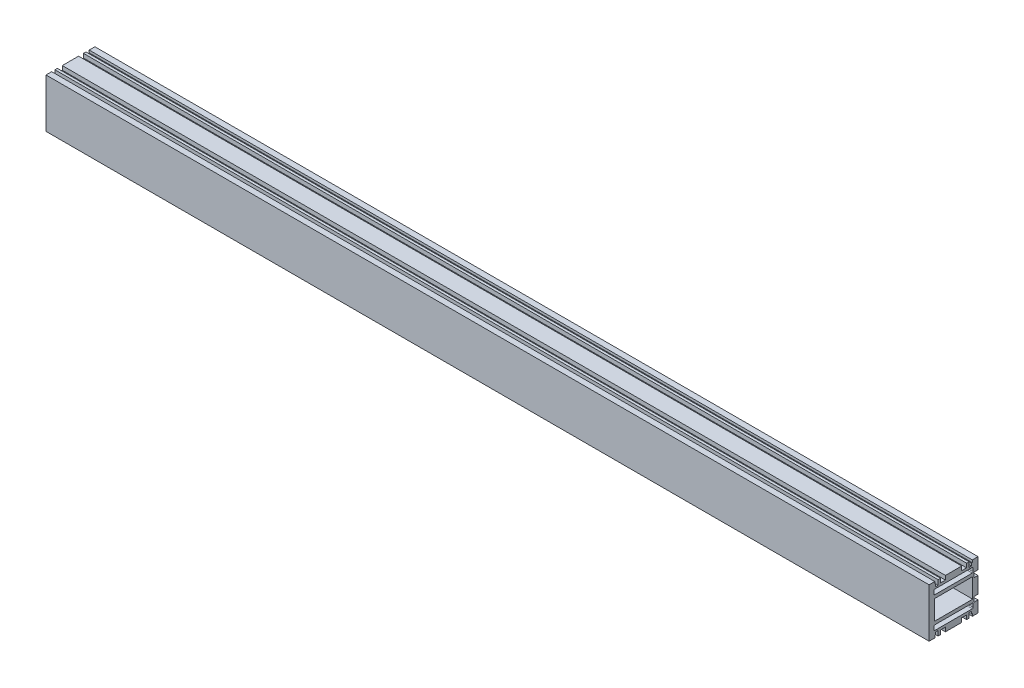
from build123d import *

# Parameters (mm, degrees)
SKETCH_1_W             = 23.5
SKETCH_1_H             = 12
EXTRUDE_1_DEPTH        = 271
HOLE_WIZARD_M6_1_D     = 5
HOLE_WIZARD_M6_1_DEPTH = 19
HOLE_WIZARD_M6_1_TIP   = 1.502151548
HOLE_WIZARD_M6_2_D     = 5
HOLE_WIZARD_M6_2_DEPTH = 19
HOLE_WIZARD_M6_2_TIP   = 1.502151548
HOLE_WIZARD_M4_1_D     = 3.3
HOLE_WIZARD_M4_1_DEPTH = 11.5
HOLE_WIZARD_M4_1_TIP   = 0.991420021


with BuildPart() as part:
    # 草图1 → 凸台-拉伸1 (new, symmetric)
    with BuildSketch(Plane(origin=(0, 0, 0), x_dir=(0, 0, -1), z_dir=(1, 0, 0))):
        Polygon((-15, 15), (-11.5, 15), (-11.5, 13.5), (-11, 13.5), (-11, 12), (-9.5, 12), (-9.5, 15), (-8, 15), (-8, 12.5), (-5, 12.5), (-5, 15), (5, 15), (5, 12.5), (8, 12.5), (8, 15), (9.5, 15), (9.5, 12), (11, 12), (11, 13.5), (11.5, 13.5), (11.5, 15), (15, 15), (15, 8), (12.5, 8), (12.5, 5), (15, 5), (15, -5), (12.5, -5), (12.5, -8), (15, -8), (15, -15), (11.5, -15), (11.5, -13.5), (11, -13.5), (11, -12), (9.5, -12), (9.5, -15), (8, -15), (8, -12.5), (5, -12.5), (5, -15), (-5, -15), (-5, -12.5), (-8, -12.5), (-8, -15), (-9.5, -15), (-9.5, -12), (-11, -12), (-11, -13.5), (-11.5, -13.5), (-11.5, -15), (-15, -15), align=None)
        with BuildLine():
            Line((12, -10.5), (12, -8.5))
            ThreePointArc((12, -8.5), (11.853553391, -8.146446609), (11.5, -8))
            Line((11.5, -8), (-11.5, -8))
            ThreePointArc((-11.5, -8), (-11.853553391, -8.146446609), (-12, -8.5))
            Line((-12, -8.5), (-12, -10.5))
            ThreePointArc((-12, -10.5), (-11.853553391, -10.853553391), (-11.5, -11))
            Line((-11.5, -11), (11.5, -11))
            ThreePointArc((11.5, -11), (11.853553391, -10.853553391), (12, -10.5))
        make_face(mode=Mode.SUBTRACT)
        with BuildLine():
            Line((-11.5, 11), (11.5, 11))
            ThreePointArc((11.5, 11), (11.853553391, 10.853553391), (12, 10.5))
            Line((12, 10.5), (12, 8.5))
            ThreePointArc((12, 8.5), (11.853553391, 8.146446609), (11.5, 8))
            Line((11.5, 8), (-11.5, 8))
            ThreePointArc((-11.5, 8), (-11.853553391, 8.146446609), (-12, 8.5))
            Line((-12, 8.5), (-12, 10.5))
            ThreePointArc((-12, 10.5), (-11.853553391, 10.853553391), (-11.5, 11))
        make_face(mode=Mode.SUBTRACT)
        Rectangle(SKETCH_1_W, SKETCH_1_H, mode=Mode.SUBTRACT)
    extrude(amount=EXTRUDE_1_DEPTH, both=True)

    # M6 螺纹孔1
    with Locations(Plane(origin=(0, -15, 0), x_dir=(-1, 0, 0), z_dir=(0, -1, 0))):
        with Locations((-236, 0), (-251, 0), (251, 0), (236, 0)):
            Hole(HOLE_WIZARD_M6_1_D / 2, depth=HOLE_WIZARD_M6_1_DEPTH)
            with Locations((0, 0, -(HOLE_WIZARD_M6_1_DEPTH + HOLE_WIZARD_M6_1_TIP / 2))):  # 118° drill point
                Cone(0, HOLE_WIZARD_M6_1_D / 2, HOLE_WIZARD_M6_1_TIP, mode=Mode.SUBTRACT)

    # M6 螺纹孔2
    with Locations(Plane(origin=(0, 0, -15), x_dir=(-1, 0, 0), z_dir=(0, 0, -1))):
        with Locations((236, 0), (251, 0)):
            Hole(HOLE_WIZARD_M6_2_D / 2, depth=HOLE_WIZARD_M6_2_DEPTH)
            with Locations((0, 0, -(HOLE_WIZARD_M6_2_DEPTH + HOLE_WIZARD_M6_2_TIP / 2))):  # 118° drill point
                Cone(0, HOLE_WIZARD_M6_2_D / 2, HOLE_WIZARD_M6_2_TIP, mode=Mode.SUBTRACT)

    # M4 螺纹孔1
    with Locations(Plane(origin=(0, 0, -15), x_dir=(-1, 0, 0), z_dir=(0, 0, -1))):
        with Locations((-258, 0), (-60.5, 0), (-21.500000001, 0), (200.999999999, 0)):
            Hole(HOLE_WIZARD_M4_1_D / 2, depth=HOLE_WIZARD_M4_1_DEPTH)
            with Locations((0, 0, -(HOLE_WIZARD_M4_1_DEPTH + HOLE_WIZARD_M4_1_TIP / 2))):  # 118° drill point
                Cone(0, HOLE_WIZARD_M4_1_D / 2, HOLE_WIZARD_M4_1_TIP, mode=Mode.SUBTRACT)


solid = part.part
